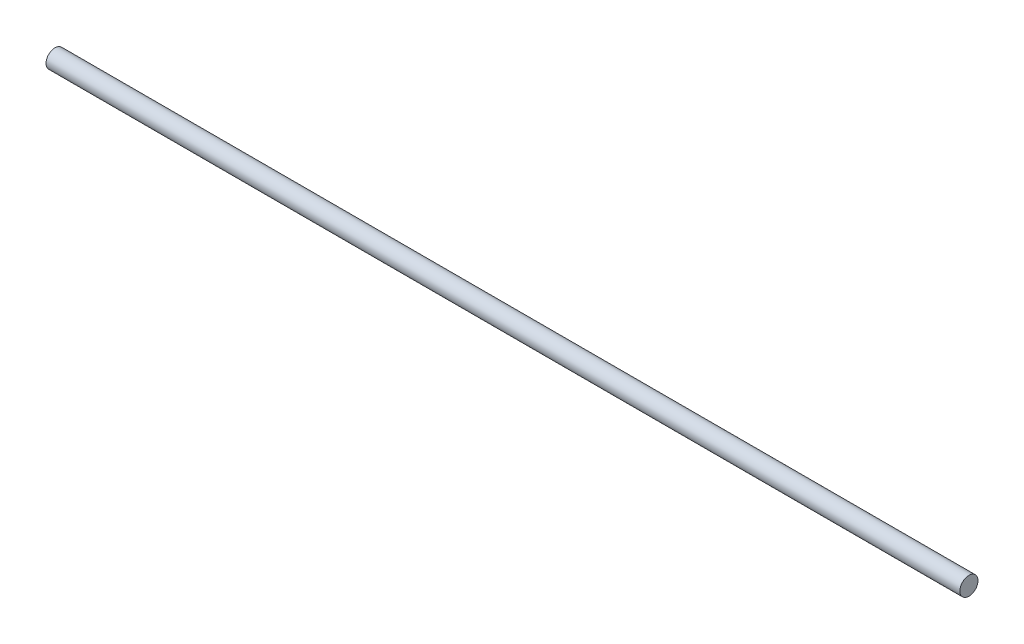
from build123d import *

# Parameters (mm, degrees)
SKETCH1_R           = 7.9375
BOSS_EXTRUDE1_DEPTH = 800


with BuildPart() as part:
    # Sketch1 → Boss-Extrude1 (new body)
    with BuildSketch(Plane(origin=(0, 0, 0), x_dir=(0, 0, -1), z_dir=(1, 0, 0))):
        with Locations(Location((0, 0, 0), (0, 0, 270))):
            Circle(SKETCH1_R)
    extrude(amount=BOSS_EXTRUDE1_DEPTH)


solid = part.part
